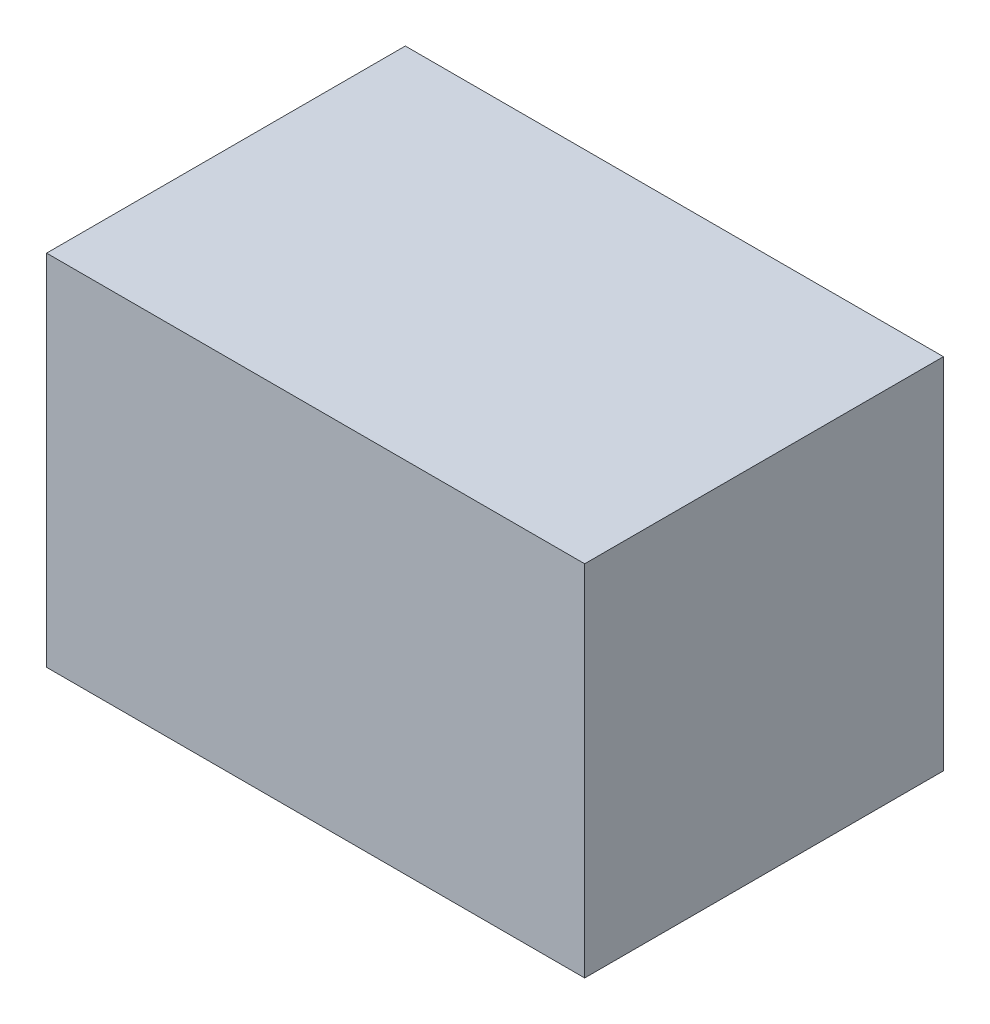
from build123d import *

# Parameters (mm, degrees)
SKIZZE2_W                       = 135
SKIZZE2_H                       = 90
AUFSATZ_LINEAR_AUSTRAGEN1_DEPTH = 90


with BuildPart() as part:
    # Skizze2 → Aufsatz-Linear austragen1 (new body)
    with BuildSketch(Plane(origin=(0, 0, 0), x_dir=(1, 0, 0), z_dir=(0, 1, 0))):
        Rectangle(SKIZZE2_W, SKIZZE2_H)
    extrude(amount=AUFSATZ_LINEAR_AUSTRAGEN1_DEPTH)


solid = part.part
